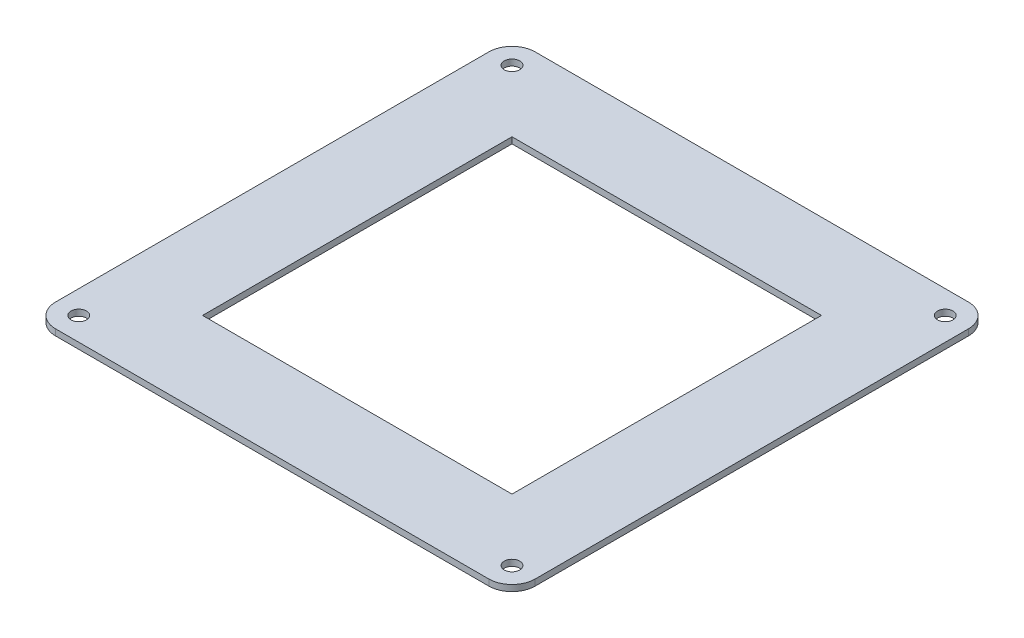
from build123d import *

# Parameters (mm, degrees)
CROQUIS1_R              = 2.5
SALIENTE_EXTRUIR1_DEPTH = 2
CROQUIS2_W              = 100
CROQUIS2_H              = 100
CORTAR_EXTRUIR1_DEPTH   = 10


with BuildPart() as part:
    # Croquis1 → Saliente-Extruir1 (new body)
    with BuildSketch(Plane(origin=(0, 0, 0), x_dir=(1, 0, 0), z_dir=(0, 1, 0))):
        with BuildLine():
            Line((17.5, 10), (157.5, 10))
            ThreePointArc((157.5, 10), (162.803300859, 12.196699141), (165, 17.5))
            Line((165, 17.5), (165, 157.5))
            ThreePointArc((165, 157.5), (162.803300859, 162.803300859), (157.5, 165))
            Line((157.5, 165), (17.5, 165))
            ThreePointArc((17.5, 165), (12.196699141, 162.803300859), (10, 157.5))
            Line((10, 157.5), (10, 17.5))
            ThreePointArc((10, 17.5), (12.196699141, 12.196699141), (17.5, 10))
        make_face()
        with Locations(Location((17.5, 157.5, 0), (0, 0, 270))):
            Circle(CROQUIS1_R, mode=Mode.SUBTRACT)
        with Locations(Location((157.5, 157.5, 0), (0, 0, 270))):
            Circle(CROQUIS1_R, mode=Mode.SUBTRACT)
        with Locations(Location((157.5, 17.5, 0), (0, 0, 270))):
            Circle(CROQUIS1_R, mode=Mode.SUBTRACT)
        with Locations(Location((17.5, 17.5, 0), (0, 0, 270))):
            Circle(CROQUIS1_R, mode=Mode.SUBTRACT)
    extrude(amount=SALIENTE_EXTRUIR1_DEPTH)

    # Croquis2 → Cortar-Extruir1 (cut)
    with BuildSketch(Plane(origin=(0, 2, 0), x_dir=(1, 0, 0), z_dir=(0, 1, 0))):
        with Locations((87.5, 87.5)):
            Rectangle(CROQUIS2_W, CROQUIS2_H)
    extrude(amount=-CORTAR_EXTRUIR1_DEPTH, mode=Mode.SUBTRACT)


solid = part.part
